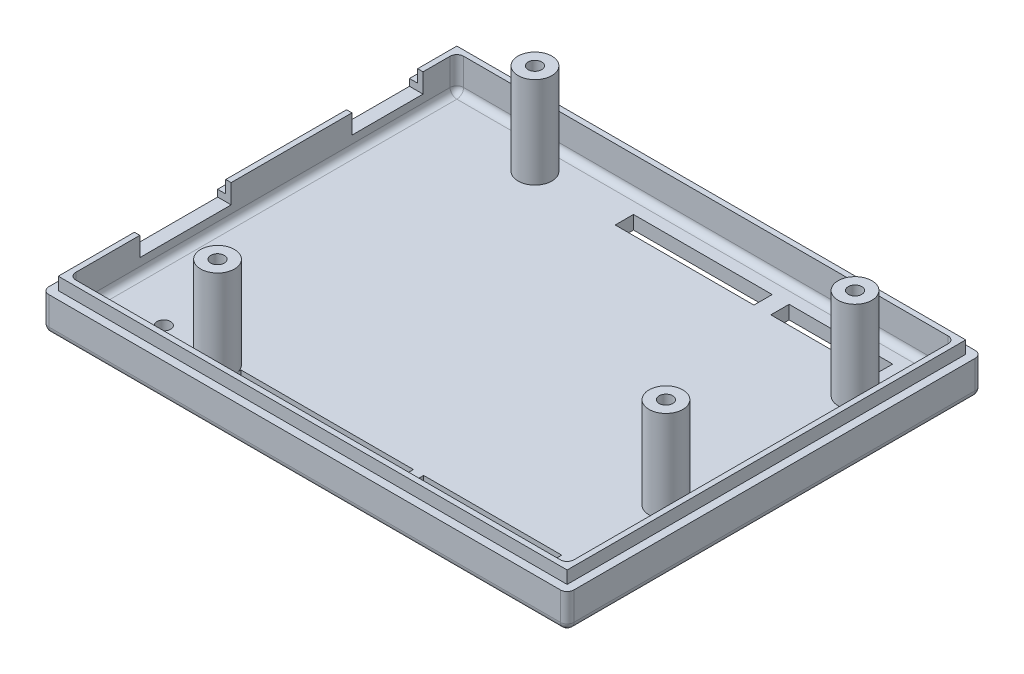
from build123d import *

# Parameters (mm, degrees)
SKETCH1_W               = 77.6
SKETCH1_H               = 61.3
BOSS_EXTRUDE1_DEPTH     = 7
SKETCH2_W               = 95.2
SKETCH2_H               = 78.9
SKETCH2_W_2             = 75.2
SKETCH2_H_2             = 58.9
CUT_EXTRUDE_THIN1_DEPTH = 1.85
SKETCH3_W               = 73.6
SKETCH3_H               = 57.3
CUT_EXTRUDE1_DEPTH      = 5
SKETCH4_W               = 13.5
SKETCH4_H               = 2.85
SKETCH4_W_2             = 10.5
CUT_EXTRUDE2_DEPTH      = 5
FILLET1_R               = 1
CUT_EXTRUDE3_REACH      = 51.698
SKETCH5_W               = 20.41
SKETCH5_H               = 2.7
SKETCH5_W_2             = 15.3
SKETCH5_W_3             = 20.5
SKETCH5_W_4             = 25.49
SKETCH6_R               = 2.5
BOSS_EXTRUDE2_DEPTH     = 13.5
SKETCH7_R               = 1
CUT_EXTRUDE4_DEPTH      = 5
CUT_EXTRUDE5_REACH      = 53.255
SKETCH8_R               = 1


with BuildPart() as part:
    # Sketch1 → Boss-Extrude1 (new body)
    with BuildSketch(Plane(origin=(0, 0, 0), x_dir=(1, 0, 0), z_dir=(0, 1, 0))):
        Rectangle(SKETCH1_W, SKETCH1_H)
    extrude(amount=BOSS_EXTRUDE1_DEPTH)

    # Sketch2 → Cut-Extrude-Thin1 (cut)
    with BuildSketch(Plane(origin=(0, 7, 0), x_dir=(1, 0, 0), z_dir=(0, 1, 0))):
        Rectangle(SKETCH2_W, SKETCH2_H)
        Rectangle(SKETCH2_W_2, SKETCH2_H_2, mode=Mode.SUBTRACT)
    extrude(amount=-CUT_EXTRUDE_THIN1_DEPTH, mode=Mode.SUBTRACT)

    # Sketch3 → Cut-Extrude1 (cut)
    with BuildSketch(Plane(origin=(0, 7, 0), x_dir=(1, 0, 0), z_dir=(0, 1, 0))):
        Rectangle(SKETCH3_W, SKETCH3_H)
    extrude(amount=-CUT_EXTRUDE1_DEPTH, mode=Mode.SUBTRACT)

    # Sketch4 → Cut-Extrude2 (cut)
    with BuildSketch(Plane.ZY.offset(38.8)):
        with Locations((11.45, 5.575)):
            Rectangle(SKETCH4_W, SKETCH4_H)
        with Locations((-18.4, 5.575)):
            Rectangle(SKETCH4_W_2, SKETCH4_H)
    extrude(amount=-CUT_EXTRUDE2_DEPTH, mode=Mode.SUBTRACT)

    # Fillet1
    fillet1_edges = [part.edges().sort_by_distance(p)[0] for p in [
        (38.8, 2.575, 30.65),
        (-38.8, 2.575, 30.65),
        (-38.8, 2.575, -30.65),
        (38.8, 2.575, -30.65),
        (36.8, 2, 0),
        (36.8, 4.5, -28.65),
        (0, 2, 28.65),
        (36.8, 4.5, 28.65),
        (-36.8, 2, 0),
        (-36.8, 4.5, 28.65),
        (0, 2, -28.65),
        (-36.8, 4.5, -28.65),
        (0, 0, 30.65),
        (-38.8, 0, 0),
        (0, 0, -30.65),
        (38.8, 0, 0),
    ]]
    fillet(fillet1_edges, radius=FILLET1_R)

    # Sketch5 → Cut-Extrude3 (cut, up to next)
    with BuildSketch(Plane(origin=(0, 2, 0), x_dir=(1, 0, 0), z_dir=(0, 1, 0)), mode=Mode.PRIVATE) as cut_extrude3_sk1:
        with Locations((20.095, -24.3)):
            Rectangle(SKETCH5_W, SKETCH5_H)
    cut_extrude3_tool1 = extrude(cut_extrude3_sk1.sketch, amount=-CUT_EXTRUDE3_REACH, mode=Mode.PRIVATE) & part.part
    # Sketch5 → Cut-Extrude3 (cut, up to next)
    with BuildSketch(Plane(origin=(0, 2, 0), x_dir=(1, 0, 0), z_dir=(0, 1, 0)), mode=Mode.PRIVATE) as cut_extrude3_sk2:
        with Locations((22.65, 24.6)):
            Rectangle(SKETCH5_W_2, SKETCH5_H)
    cut_extrude3_tool2 = extrude(cut_extrude3_sk2.sketch, amount=-CUT_EXTRUDE3_REACH, mode=Mode.PRIVATE) & part.part
    # Sketch5 → Cut-Extrude3 (cut, up to next)
    with BuildSketch(Plane(origin=(0, 2, 0), x_dir=(1, 0, 0), z_dir=(0, 1, 0)), mode=Mode.PRIVATE) as cut_extrude3_sk3:
        with Locations((2.25, 24.6)):
            Rectangle(SKETCH5_W_3, SKETCH5_H)
    cut_extrude3_tool3 = extrude(cut_extrude3_sk3.sketch, amount=-CUT_EXTRUDE3_REACH, mode=Mode.PRIVATE) & part.part
    # Sketch5 → Cut-Extrude3 (cut, up to next)
    with BuildSketch(Plane(origin=(0, 2, 0), x_dir=(1, 0, 0), z_dir=(0, 1, 0)), mode=Mode.PRIVATE) as cut_extrude3_sk4:
        with Locations((-4.355, -24.3)):
            Rectangle(SKETCH5_W_4, SKETCH5_H)
    cut_extrude3_tool4 = extrude(cut_extrude3_sk4.sketch, amount=-CUT_EXTRUDE3_REACH, mode=Mode.PRIVATE) & part.part
    add(cut_extrude3_tool1.solids().sort_by_distance((20.095, 2, 24.3))[0], mode=Mode.SUBTRACT)
    add(cut_extrude3_tool2.solids().sort_by_distance((22.65, 2, -24.6))[0], mode=Mode.SUBTRACT)
    add(cut_extrude3_tool3.solids().sort_by_distance((2.25, 2, -24.6))[0], mode=Mode.SUBTRACT)
    add(cut_extrude3_tool4.solids().sort_by_distance((-4.355, 2, 24.3))[0], mode=Mode.SUBTRACT)

    # Sketch6 → Boss-Extrude2 (add)
    with BuildSketch(Plane(origin=(0, 2, 0), x_dir=(1, 0, 0), z_dir=(0, 1, 0))):
        with Locations(Location((31.6, 19.09, 0), (0, 0, 270))):
            Circle(SKETCH6_R)
        with Locations(Location((31.6, -8.85, 0), (0, 0, 270))):
            Circle(SKETCH6_R)
        with Locations(Location((-19.5, -24.01, 0), (0, 0, 16.260204708))):
            Circle(SKETCH6_R)
        with Locations(Location((-20.8, 24.19, 0), (0, 0, 270))):
            Circle(SKETCH6_R)
    extrude(amount=BOSS_EXTRUDE2_DEPTH)

    # Sketch7 → Cut-Extrude4 (cut)
    with BuildSketch(Plane(origin=(0, 15.5, 0), x_dir=(1, 0, 0), z_dir=(0, 1, 0))):
        with Locations(Location((31.6, 19.09, 0), (0, 0, 270))):
            Circle(SKETCH7_R)
        with Locations(Location((31.6, -8.85, 0), (0, 0, 270))):
            Circle(SKETCH7_R)
        with Locations(Location((-20.8, 24.19, 0), (0, 0, 270))):
            Circle(SKETCH7_R)
        with Locations(Location((-19.5, -24.01, 0), (0, 0, 270))):
            Circle(SKETCH7_R)
    extrude(amount=-CUT_EXTRUDE4_DEPTH, mode=Mode.SUBTRACT)

    # Sketch8 → Cut-Extrude5 (cut, up to next)
    with BuildSketch(Plane(origin=(0, 2, 0), x_dir=(1, 0, 0), z_dir=(0, 1, 0)), mode=Mode.PRIVATE) as cut_extrude5_sk1:
        with Locations(Location((-28.5, -22.95, 0), (0, 0, 270))):
            Circle(SKETCH8_R)
    cut_extrude5_tool1 = extrude(cut_extrude5_sk1.sketch, amount=-CUT_EXTRUDE5_REACH, mode=Mode.PRIVATE) & part.part
    add(cut_extrude5_tool1.solids().sort_by_distance((-28.5, 2, 22.95))[0], mode=Mode.SUBTRACT)


solid = part.part
